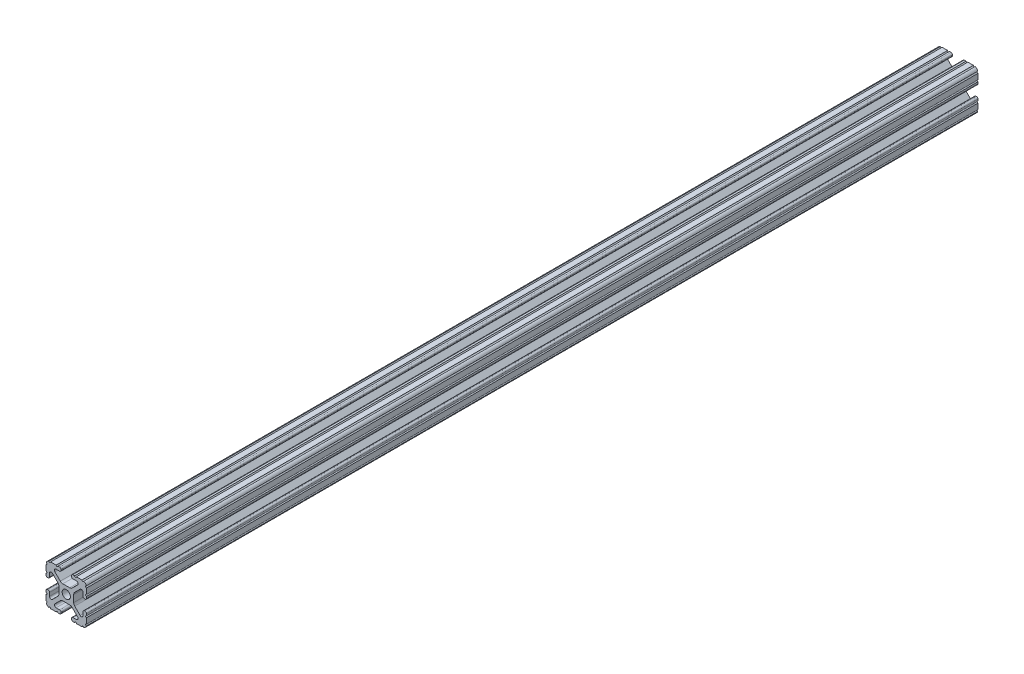
from build123d import *

# Parameters (mm, degrees)
BOSS_EXTRUDE1_DEPTH     = 1524
CUT_EXTRUDE1_DEPTH      = 1525.105829659
CUT_EXTRUDE1_DEPTH_BACK = 1525.105829659
SKETCH5_R               = 0.55245
CUT_EXTRUDE2_DEPTH      = 1525.105829659
CUT_EXTRUDE2_DEPTH_BACK = 1525.105829659
SKETCH8_W               = 50.559993734
SKETCH8_H               = 1231.9
CUT_EXTRUDE3_DEPTH      = 1525.105829659
CUT_EXTRUDE3_DEPTH_BACK = 1525.105829659
SKETCH9_W               = 50.679996867
SKETCH9_H               = 1282.7


with BuildPart() as part:
    # Sketch4 → Boss-Extrude1 (new, symmetric)
    with BuildSketch(Plane.XY):
        with BuildLine():
            Line((4.190365, -12.7), (10.11729625, -12.7))
            ThreePointArc((10.11729625, -12.7), (11.943543585, -11.943543585), (12.7, -10.11729625))
            Line((12.7, -10.11729625), (12.7, -4.190365))
            ThreePointArc((12.7, -4.190365), (12.42492494, -3.52627506), (11.760835, -3.2512))
            Line((11.760835, -3.2512), (11.429365, -3.2512))
            ThreePointArc((11.429365, -3.2512), (10.76527506, -3.52627506), (10.4902, -4.190365))
            Line((10.4902, -4.190365), (10.4902, -6.348478019))
            ThreePointArc((10.4902, -6.348478019), (9.830707141, -7.335478831), (8.666460301, -7.103895736))
            Line((8.666460301, -7.103895736), (5.299899128, -3.737334563))
            ThreePointArc((5.299899128, -3.737334563), (4.817571085, -3.015479634), (4.6482, -2.16399369))
            Line((4.6482, -2.16399369), (4.6482, 0))
            Line((4.6482, 0), (2.6035, 0))
            ThreePointArc((2.6035, 0), (1.840952505, -1.840952505), (0, -2.6035))
            Line((0, -2.6035), (0, -4.6482))
            Line((0, -4.6482), (2.16399369, -4.6482))
            ThreePointArc((2.16399369, -4.6482), (3.015479634, -4.817571085), (3.737334563, -5.299899128))
            Line((3.737334563, -5.299899128), (7.103895736, -8.666460301))
            ThreePointArc((7.103895736, -8.666460301), (7.335478831, -9.830707141), (6.348478019, -10.4902))
            Line((6.348478019, -10.4902), (4.190365, -10.4902))
            ThreePointArc((4.190365, -10.4902), (3.52627506, -10.76527506), (3.2512, -11.429365))
            Line((3.2512, -11.429365), (3.2512, -11.760835))
            ThreePointArc((3.2512, -11.760835), (3.52627506, -12.42492494), (4.190365, -12.7))
        make_face()
    extrude(amount=BOSS_EXTRUDE1_DEPTH, both=True)

    # Sketch5 → Cut-Extrude1 (cut, two sides: drawn at the far end of the back side and taken through both)
    with BuildSketch(Plane.XY.offset(-CUT_EXTRUDE1_DEPTH_BACK)):
        with Locations((10.356153152, -12.7)):
            Circle(SKETCH5_R)
        with Locations((5.796028019, -12.7)):
            Circle(SKETCH5_R)
        with Locations((12.7, -10.356153152)):
            Circle(SKETCH5_R)
        with Locations((12.7, -5.796028019)):
            Circle(SKETCH5_R)
    extrude(amount=CUT_EXTRUDE1_DEPTH + CUT_EXTRUDE1_DEPTH_BACK, mode=Mode.SUBTRACT)

    # Mirror1: part across plane


with BuildPart() as part_1:
    add(part.part)
    add(part.part.mirror(Plane(origin=(0, 0, 0), x_dir=(0, 0, 1), z_dir=(1, 0, 0))))

    # Mirror2: part across plane


with BuildPart() as part_2:
    add(part_1.part)
    add(part_1.part.mirror(Plane.ZX))

    # Sketch8 → Cut-Extrude2 (cut, two sides: drawn at the far end of the back side and taken through both)
    with BuildSketch(Plane(origin=(0, 0, 0), x_dir=(1, 0, 0), z_dir=(0, 1, 0)).offset(-CUT_EXTRUDE2_DEPTH_BACK)):
        with Locations((0, 920.75)):
            Rectangle(SKETCH8_W, SKETCH8_H)
    extrude(amount=CUT_EXTRUDE2_DEPTH + CUT_EXTRUDE2_DEPTH_BACK, mode=Mode.SUBTRACT)

    # Sketch9 → Cut-Extrude3 (cut, two sides: drawn at the far end of the back side and taken through both)
    with BuildSketch(Plane(origin=(0, 0, 0), x_dir=(1, 0, 0), z_dir=(0, 1, 0)).offset(-CUT_EXTRUDE3_DEPTH_BACK)):
        with Locations((-0.060001567, -323.85)):
            Rectangle(SKETCH9_W, SKETCH9_H)
    extrude(amount=CUT_EXTRUDE3_DEPTH + CUT_EXTRUDE3_DEPTH_BACK, mode=Mode.SUBTRACT)


solid = part_2.part
